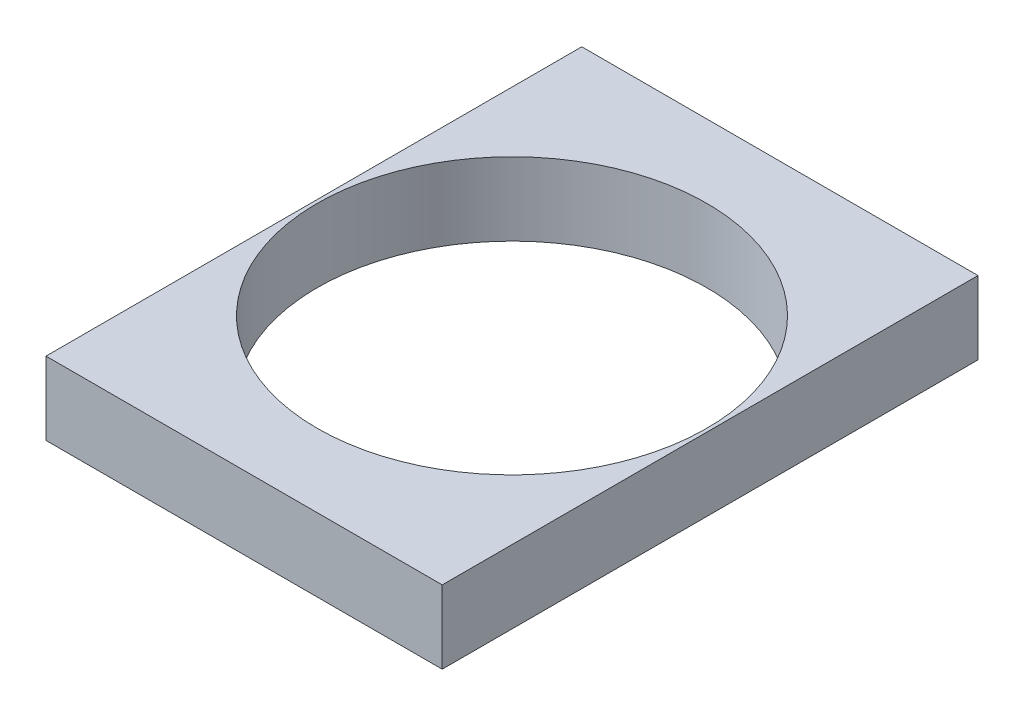
from build123d import *

# Parameters (mm, degrees)
SKETCH1_W           = 16.27
SKETCH1_H           = 22
SKETCH1_R           = 8
BOSS_EXTRUDE1_DEPTH = 3


with BuildPart() as part:
    # Sketch1 → Boss-Extrude1 (new body)
    with BuildSketch(Plane(origin=(0, 0, 0), x_dir=(1, 0, 0), z_dir=(0, 1, 0))):
        Rectangle(SKETCH1_W, SKETCH1_H)
        Circle(SKETCH1_R, mode=Mode.SUBTRACT)
    extrude(amount=BOSS_EXTRUDE1_DEPTH)


solid = part.part
